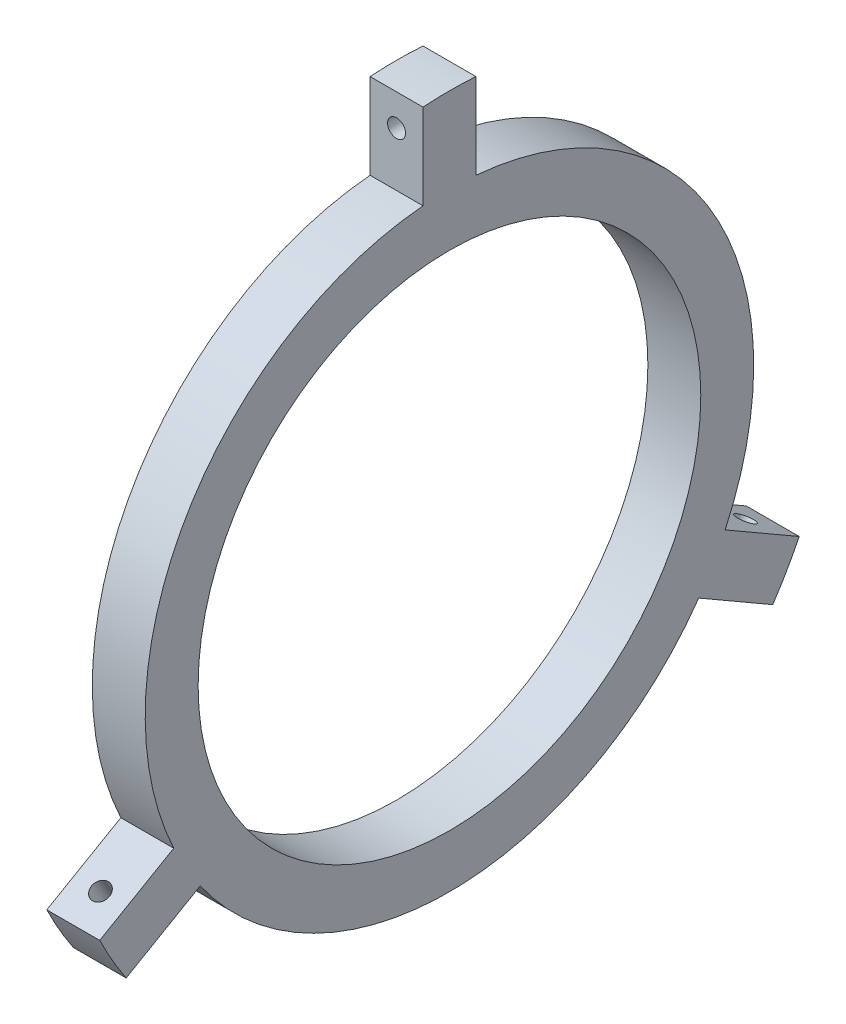
from build123d import *

# Parameters (mm, degrees)
ESQUISSE2_W                  = 10
ESQUISSE2_H                  = 73.61
BOSS_EXTRU_1_DEPTH           = 5
ENL_V_MAT_EXTRU_1_DEPTH      = 75.454228221
D_GAGEMENT_M31_D             = 3.4
R_P_TITION_CIRCULAIRE1_COUNT = 3
ESQUISSE8_R                  = 57.5
BOSS_EXTRU_2_DEPTH           = 10
ESQUISSE9_R                  = 47.5
ENL_V_MAT_EXTRU_3_DEPTH      = 100.437219687


with BuildPart() as part:
    # Esquisse2 → Boss.-Extru.1 (new, symmetric)
    with BuildSketch(Plane.XY):
        with Locations((0, 36.805)):
            Rectangle(ESQUISSE2_W, ESQUISSE2_H)
    boss_extru_1 = extrude(amount=BOSS_EXTRU_1_DEPTH, both=True)

    # Esquisse3 → Enlèv. mat.-Extru.1 (cut, through all)
    with BuildSketch(Plane(origin=(5, 0, 0), x_dir=(0, 0, -1), z_dir=(1, 0, 0))):
        with BuildLine():
            Line((-25.399222728, 69.089156782), (-25.399222728, 83.587655611))
            Line((-25.399222728, 83.587655611), (25.399222728, 83.587655611))
            Line((25.399222728, 83.587655611), (25.399222728, 69.089156782))
            ThreePointArc((25.399222728, 69.089156782), (0, 73.61), (-25.399222728, 69.089156782))
        make_face()
    enl_v_mat_extru_1 = extrude(amount=-ENL_V_MAT_EXTRU_1_DEPTH, mode=Mode.SUBTRACT)

    # Dégagement M31 (through all)
    with Locations(Plane(origin=(0, 0, -5), x_dir=(-1, 0, 0), z_dir=(0, 0, -1))):
        with Locations((0, 67.5)):
            d_gagement_m31 = Hole(D_GAGEMENT_M31_D / 2)

    # Répétition circulaire1: Boss.-Extru.1, Enlèv. mat.-Extru.1, Dégagement M31 ×3 about axis
    r_p_tition_circulaire1_axis = Axis((0, 0, 0), (1, 0, 0))
    add([boss_extru_1.rotate(r_p_tition_circulaire1_axis, i * 360 / R_P_TITION_CIRCULAIRE1_COUNT) for i in range(1, R_P_TITION_CIRCULAIRE1_COUNT)])
    add([enl_v_mat_extru_1.rotate(r_p_tition_circulaire1_axis, i * 360 / R_P_TITION_CIRCULAIRE1_COUNT) for i in range(1, R_P_TITION_CIRCULAIRE1_COUNT)], mode=Mode.SUBTRACT)
    add([d_gagement_m31.rotate(r_p_tition_circulaire1_axis, i * 360 / R_P_TITION_CIRCULAIRE1_COUNT) for i in range(1, R_P_TITION_CIRCULAIRE1_COUNT)], mode=Mode.SUBTRACT)

    # Esquisse8 → Boss.-Extru.2 (add)
    with BuildSketch(Plane(origin=(5, 0, 0), x_dir=(0, 0, -1), z_dir=(1, 0, 0))):
        Circle(ESQUISSE8_R)
    extrude(amount=-BOSS_EXTRU_2_DEPTH)

    # Esquisse9 → Enlèv. mat.-Extru.3 (cut, through all)
    with BuildSketch(Plane(origin=(5, 0, 0), x_dir=(0, 0, -1), z_dir=(1, 0, 0))):
        Circle(ESQUISSE9_R)
    extrude(amount=-ENL_V_MAT_EXTRU_3_DEPTH, mode=Mode.SUBTRACT)


solid = part.part
